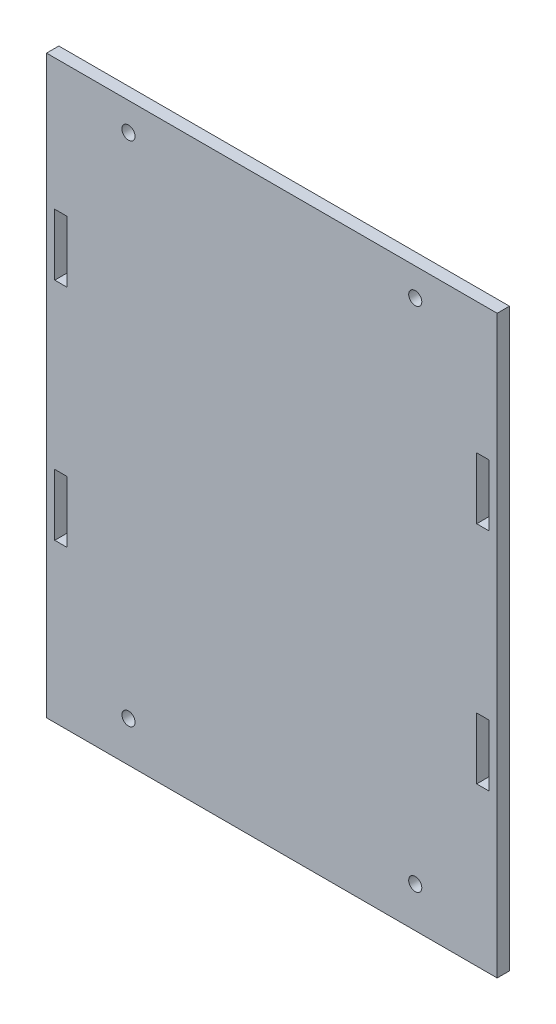
from build123d import *

# Parameters (mm, degrees)
SKETCH_1_W      = 100
SKETCH_1_H      = 140.533333334
SKETCH_1_R      = 1.6
EXTRUDE_1_DEPTH = 3
EXTRUDE_2_DEPTH = 3


with BuildPart() as part:
    # 草图1 → 凸台-拉伸1 (new body)
    with BuildSketch(Plane.XY):
        with Locations((0, 54.4)):
            Rectangle(SKETCH_1_W, SKETCH_1_H)
        with Locations((-35, -6)):
            Circle(SKETCH_1_R, mode=Mode.SUBTRACT)
        with Locations((35, -6)):
            Circle(SKETCH_1_R, mode=Mode.SUBTRACT)
        with Locations((-35, 117.866666667)):
            Circle(SKETCH_1_R, mode=Mode.SUBTRACT)
        with Locations((35, 117.866666667)):
            Circle(SKETCH_1_R, mode=Mode.SUBTRACT)
    extrude(amount=-EXTRUDE_1_DEPTH)

    # 草图2 → 凸台-拉伸2 (add)
    with BuildSketch(Plane.XY):
        Polygon((-50, 92.666666667), (-50, 124.666666667), (-55, 124.666666667), (-55, -15.866666667), (-50, -15.866666667), (-50, 22.666666667), (-53, 22.666666667), (-53, 37.666666667), (-50, 37.666666667), (-50, 77.666666667), (-53, 77.666666667), (-53, 92.666666667), align=None)
    extrude_2 = extrude(amount=-EXTRUDE_2_DEPTH)

    # 镜向1: 凸台-拉伸2 across plane
    add(extrude_2.mirror(Plane(origin=(0, 0, 0), x_dir=(0, 0, 1), z_dir=(1, 0, 0))))


solid = part.part
